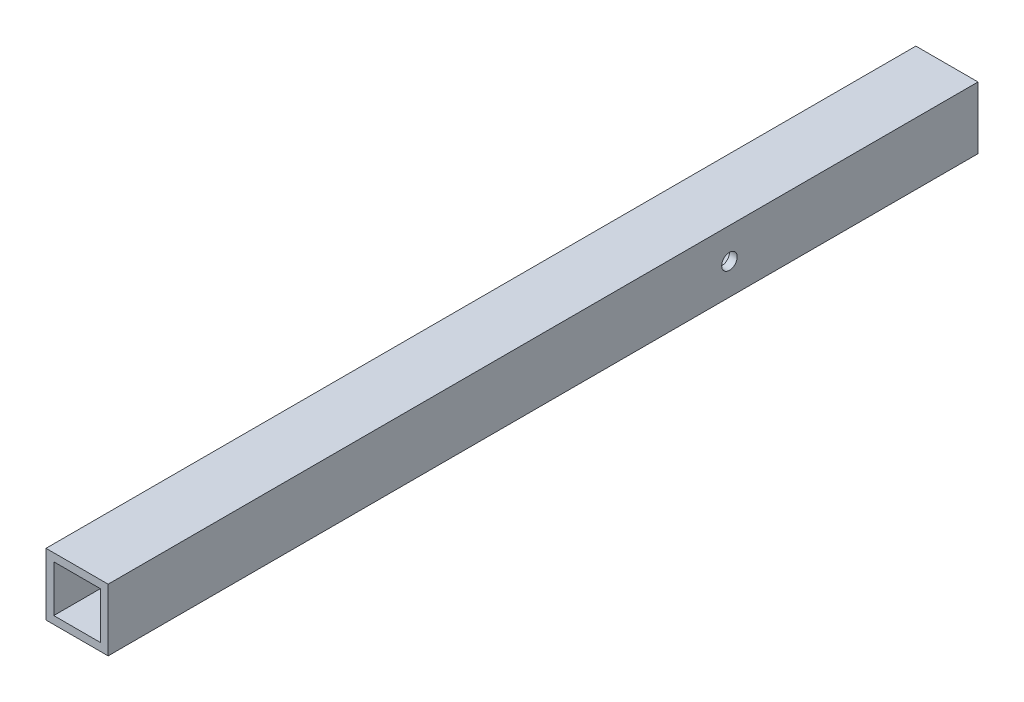
from build123d import *

# Parameters (mm, degrees)
SKETCH1_W           = 25.4
SKETCH1_H           = 25.4
SKETCH1_W_2         = 19.05
SKETCH1_H_2         = 19.05
BOSS_EXTRUDE1_DEPTH = 355.6
SKETCH2_R           = 3.175
CUT_EXTRUDE1_DEPTH  = 358.409680899


with BuildPart() as part:
    # Sketch1 → Boss-Extrude1 (new body)
    with BuildSketch(Plane.XY):
        with Locations((12.7, 12.7)):
            Rectangle(SKETCH1_W, SKETCH1_H)
        with Locations((12.7, 12.7)):
            Rectangle(SKETCH1_W_2, SKETCH1_H_2, mode=Mode.SUBTRACT)
    extrude(amount=BOSS_EXTRUDE1_DEPTH)

    # Sketch2 → Cut-Extrude1 (cut, through all)
    with BuildSketch(Plane.ZY):
        with Locations(Location((101.6, 12.7, 0), (0, 0, 270))):
            Circle(SKETCH2_R)
    extrude(amount=-CUT_EXTRUDE1_DEPTH, mode=Mode.SUBTRACT)


solid = part.part
